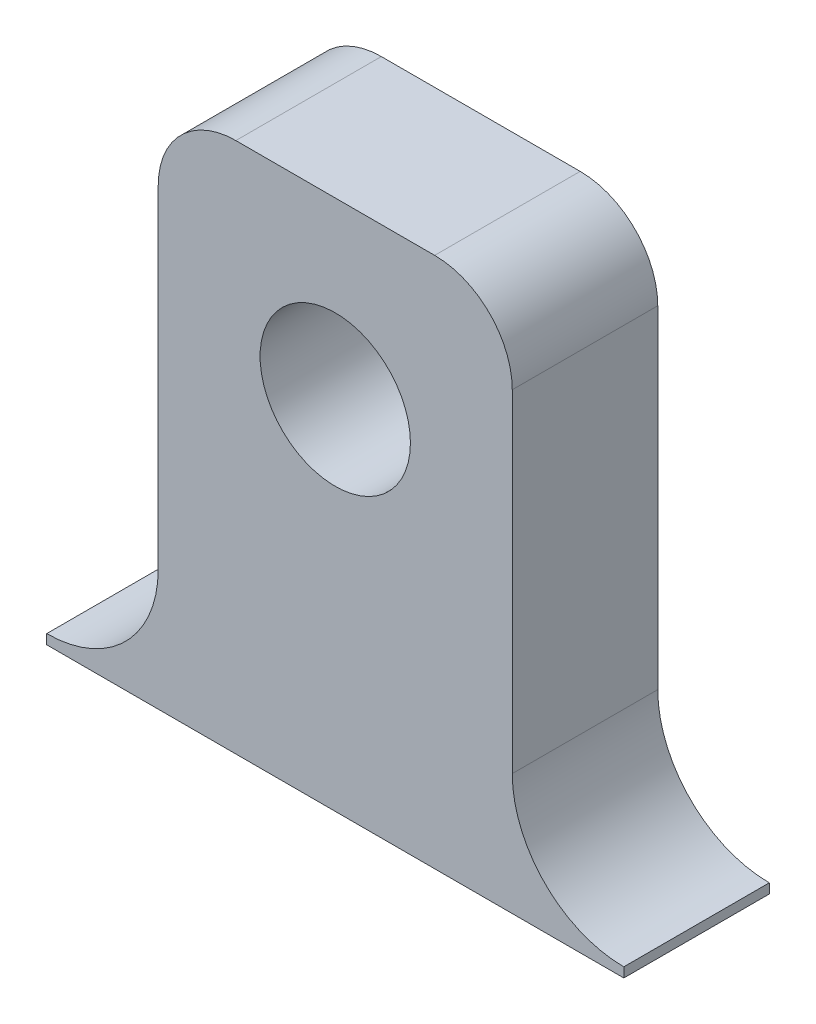
from build123d import *

# Parameters (mm, degrees)
SKETCH1_R           = 1.55
BOSS_EXTRUDE1_DEPTH = 3


with BuildPart() as part:
    # Sketch1 → Boss-Extrude1 (new body)
    with BuildSketch(Plane.XY):
        with BuildLine():
            Line((-5.95, -2.354308425), (-3.45, -2.354308425))
            Line((-3.45, -2.354308425), (3.45, -2.354308425))
            Line((3.45, -2.354308425), (5.95, -2.354308425))
            Line((5.95, -2.354308425), (5.95, -2.154308425))
            ThreePointArc((5.95, -2.154308425), (4.323654403, -1.480654022), (3.65, 0.145691575))
            Line((3.65, 0.145691575), (3.65, 3))
            Line((3.65, 3), (3.65, 7))
            ThreePointArc((3.65, 7), (3.18137085, 8.13137085), (2.05, 8.6))
            Line((2.05, 8.6), (-2.05, 8.6))
            ThreePointArc((-2.05, 8.6), (-3.18137085, 8.13137085), (-3.65, 7))
            Line((-3.65, 7), (-3.65, 3))
            Line((-3.65, 3), (-3.65, 0.145691575))
            ThreePointArc((-3.65, 0.145691575), (-4.323654403, -1.480654022), (-5.95, -2.154308425))
            Line((-5.95, -2.154308425), (-5.95, -2.354308425))
        make_face()
        with Locations((0, 5)):
            Circle(SKETCH1_R, mode=Mode.SUBTRACT)
    extrude(amount=BOSS_EXTRUDE1_DEPTH)


solid = part.part
